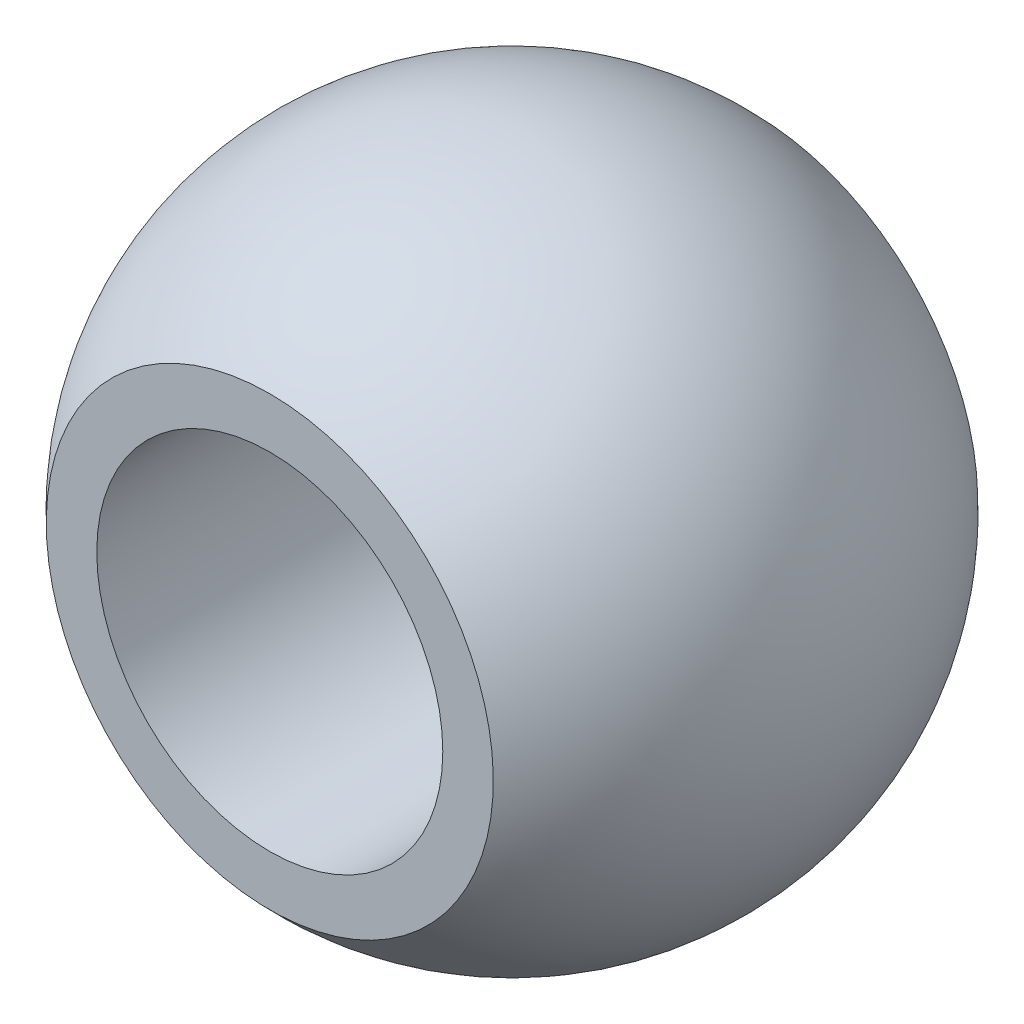
from build123d import *


with BuildPart() as part:
    # 草图1 → 旋转1 (revolve)
    with BuildSketch(Plane(origin=(0, 0, 0), x_dir=(0, 0, -1), z_dir=(1, 0, 0))):
        with BuildLine():
            Line((-7, 6.459537522), (-7, 5))
            Line((-7, 5), (7, 5))
            Line((7, 5), (7, 6.459537522))
            ThreePointArc((7, 6.459537522), (0, 9.525), (-7, 6.459537522))
        make_face()
    revolve(axis=Axis((0, 0, 7), (0, 0, -1)))


solid = part.part
